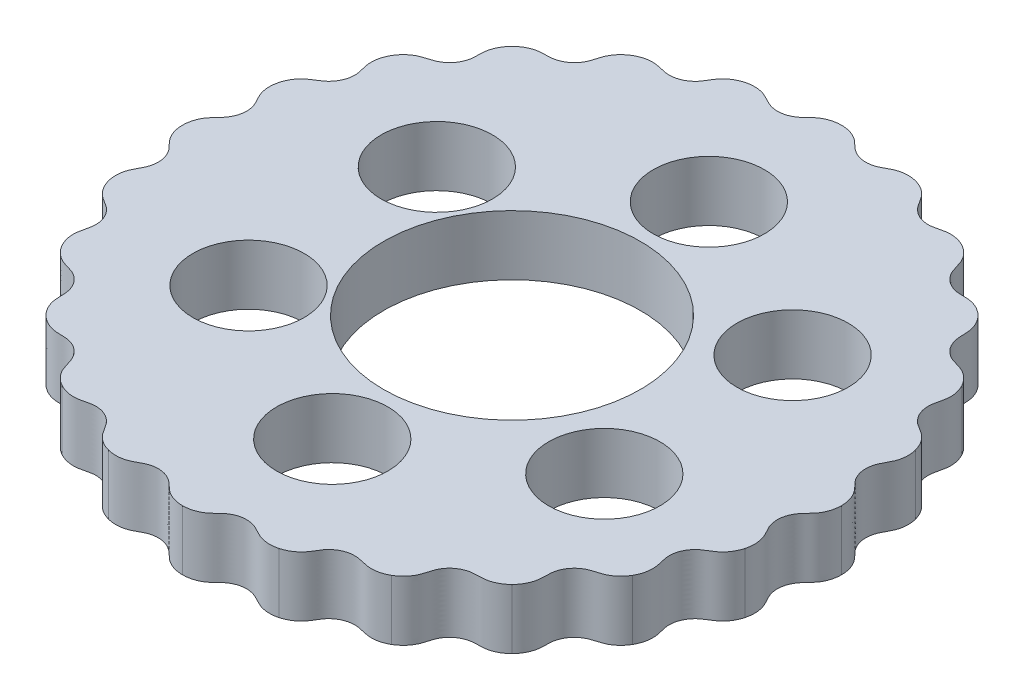
from build123d import *

# Parameters (mm, degrees)
SKETCH1_R           = 15
SKETCH1_R_2         = 6.5
BOSS_EXTRUDE1_DEPTH = 7


with BuildPart() as part:
    # Sketch1 → Boss-Extrude1 (new body)
    with BuildSketch(Plane(origin=(0, 0, 0), x_dir=(1, 0, 0), z_dir=(0, 1, 0))):
        with BuildLine():
            add(Edge.make_bspline(
                [(-38.188097082, 9.9647088), (-38.113372009, 10.244100974), (-37.951839108, 10.654037682), (-37.652977987, 11.14456219), (-37.390260931, 11.479949616), (-37.145465578, 11.725596787), (-36.927714992, 11.908277882), (-36.752948947, 12.0384598), (-36.590559186, 12.146195792), (-36.458882173, 12.226744009), (-36.305001509, 12.317396194), (-36.107721818, 12.43804004), (-35.856239089, 12.594685167), (-35.413957853, 12.936912027), (-35.008192839, 13.424260923), (-34.730315468, 13.922699482), (-34.557012484, 14.436902449), (-34.457602125, 15.223415448), (-34.576890778, 15.867285655), (-34.632823051, 16.071325063), (-34.673334751, 16.238891625), (-34.711262719, 16.392459936), (-34.752702236, 16.572074341), (-34.794830164, 16.780749484), (-34.825838307, 16.988053197), (-34.8500137, 17.262666694), (-34.849186563, 17.61539272), (-34.797869935, 18.037592245), (-34.662664385, 18.594763053), (-34.486664191, 18.999578144), (-34.341886986, 19.250157358)],
                knots=[-8.4146e-05, -8.4146e-05, -8.4146e-05, -8.4146e-05, 0.124936892, 0.187447412, 0.249957931, 0.31246845, 0.34372371, 0.37497897, 0.406234229, 0.421861859, 0.437489489, 0.453117119, 0.468744749, 0.484372378, 0.492186193, 0.500000008, 0.507813823, 0.515627638, 0.531255268, 0.546882898, 0.562510528, 0.578138157, 0.593765787, 0.625021047, 0.656276307, 0.687531566, 0.750042086, 0.812552605, 0.875063124, 1.000084163, 1.000084163, 1.000084163, 1.000084163], degree=3))
            add(Edge.make_bspline(
                [(-34.341886986, 19.250157358), (-34.197396092, 19.500689201), (-33.935267864, 19.854849864), (-33.519633104, 20.251309204), (-33.179063261, 20.507272404), (-32.879030942, 20.681191651), (-32.62141868, 20.801290039), (-32.418914084, 20.881803336), (-32.234173493, 20.943838749), (-32.086135853, 20.987561834), (-31.914036033, 21.035297874), (-31.69225356, 21.100771139), (-31.408797155, 21.186990194), (-30.893011458, 21.403085149), (-30.374937375, 21.768808321), (-29.977523054, 22.178343042), (-29.677039705, 22.630170855), (-29.377452129, 23.364154779), (-29.326030247, 24.016959816), (-29.32724739, 24.228523087), (-29.323009269, 24.400865157), (-29.31989847, 24.559017234), (-29.31343834, 24.743236764), (-29.300121693, 24.955704984), (-29.27641911, 25.163970492), (-29.228695543, 25.435483813), (-29.136604377, 25.775976912), (-28.977763043, 26.170508616), (-28.702958094, 26.673700518), (-28.428181106, 27.019169667), (-28.223482392, 27.223739503)],
                knots=[-8.4146e-05, -8.4146e-05, -8.4146e-05, -8.4146e-05, 0.124936892, 0.187447412, 0.249957931, 0.31246845, 0.34372371, 0.37497897, 0.406234229, 0.421861859, 0.437489489, 0.453117119, 0.468744749, 0.484372378, 0.492186193, 0.500000008, 0.507813823, 0.515627638, 0.531255268, 0.546882898, 0.562510528, 0.578138157, 0.593765787, 0.625021047, 0.656276307, 0.687531566, 0.750042086, 0.812552605, 0.875063124, 1.000084163, 1.000084163, 1.000084163, 1.000084163], degree=3))
            add(Edge.make_bspline(
                [(-28.223482392, 27.223739503), (-28.019072493, 27.428337686), (-27.674212543, 27.702586839), (-27.170128967, 27.977962964), (-26.774915608, 28.137058467), (-26.440093029, 28.227397481), (-26.160174942, 28.276728657), (-25.943732148, 28.302086483), (-25.749230494, 28.314193708), (-25.594920747, 28.318112004), (-25.41633009, 28.319678767), (-25.185158943, 28.325519557), (-24.889045948, 28.335436852), (-24.334905732, 28.410673388), (-23.739828474, 28.629847406), (-23.249960332, 28.922569175), (-22.842774062, 29.281230515), (-22.363425666, 29.912665573), (-22.144797566, 30.529917856), (-22.091216632, 30.734587303), (-22.042517512, 30.899960052), (-21.998579941, 31.051918094), (-21.944660412, 31.228188491), (-21.876806697, 31.42997043), (-21.800008679, 31.625004783), (-21.683638435, 31.874914744), (-21.506559101, 32.179970874), (-21.251017835, 32.519948074), (-20.85534099, 32.934869374), (-20.500512806, 33.197449429), (-20.249842461, 33.342068792)],
                knots=[-8.4146e-05, -8.4146e-05, -8.4146e-05, -8.4146e-05, 0.124936892, 0.187447412, 0.249957931, 0.31246845, 0.34372371, 0.37497897, 0.406234229, 0.421861859, 0.437489489, 0.453117119, 0.468744749, 0.484372378, 0.492186193, 0.500000008, 0.507813823, 0.515627638, 0.531255268, 0.546882898, 0.562510528, 0.578138157, 0.593765787, 0.625021047, 0.656276307, 0.687531566, 0.750042086, 0.812552605, 0.875063124, 1.000084163, 1.000084163, 1.000084163, 1.000084163], degree=3))
            add(Edge.make_bspline(
                [(-20.249842461, 33.342068792), (-19.999443754, 33.486790286), (-19.595353719, 33.662438303), (-19.037173788, 33.797964783), (-18.614250052, 33.849350495), (-18.267454818, 33.849952821), (-17.984306861, 33.825154945), (-17.768676088, 33.793629208), (-17.577668336, 33.754983156), (-17.427602437, 33.718829639), (-17.254691601, 33.674120352), (-17.029885713, 33.619930626), (-16.741295738, 33.552870315), (-16.186564743, 33.482121187), (-15.555037841, 33.539809704), (-15.006099582, 33.695770015), (-14.519959463, 33.936822705), (-13.893517049, 34.422677641), (-13.522581874, 34.962312446), (-13.417854315, 35.146140185), (-13.328012961, 35.293273735), (-13.24624289, 35.428682052), (-13.148538489, 35.584990779), (-13.030771824, 35.762335332), (-12.906112031, 35.930847261), (-12.729025549, 36.142122911), (-12.479025711, 36.390953001), (-12.144199228, 36.653206813), (-11.65461521, 36.951581309), (-11.243916784, 37.113377874), (-10.964357579, 37.188191192)],
                knots=[-8.4146e-05, -8.4146e-05, -8.4146e-05, -8.4146e-05, 0.124936892, 0.187447412, 0.249957931, 0.31246845, 0.34372371, 0.37497897, 0.406234229, 0.421861859, 0.437489489, 0.453117119, 0.468744749, 0.484372378, 0.492186193, 0.500000008, 0.507813823, 0.515627638, 0.531255268, 0.546882898, 0.562510528, 0.578138157, 0.593765787, 0.625021047, 0.656276307, 0.687531566, 0.750042086, 0.812552605, 0.875063124, 1.000084163, 1.000084163, 1.000084163, 1.000084163], degree=3))
            add(Edge.make_bspline(
                [(-10.964357579, 37.188191192), (-10.685034322, 37.263173466), (-10.249252269, 37.328250225), (-9.675015023, 37.314691156), (-9.253202464, 37.254865224), (-8.918068097, 37.165689816), (-8.650986335, 37.068452823), (-8.450862464, 36.982191949), (-8.276365478, 36.895426285), (-8.140770169, 36.821664756), (-7.985322742, 36.733726284), (-7.782202261, 36.623198983), (-7.520802237, 36.483731115), (-7.003284465, 36.271817759), (-6.378345433, 36.164089397), (-5.807746293, 36.172659814), (-5.275781969, 36.279676511), (-4.544936552, 36.586841114), (-4.046972922, 37.012083221), (-3.898235749, 37.162541695), (-3.773374699, 37.281409137), (-3.659344625, 37.391039876), (-3.524513745, 37.516734753), (-3.364859734, 37.657556181), (-3.200833523, 37.788061877), (-2.975098956, 37.946305129), (-2.669215688, 38.121951821), (-2.27792186, 38.28861008), (-1.727795011, 38.450104043), (-1.289214762, 38.500090949), (-0.999818195, 38.499999819)],
                knots=[-8.4146e-05, -8.4146e-05, -8.4146e-05, -8.4146e-05, 0.124936892, 0.187447412, 0.249957931, 0.31246845, 0.34372371, 0.37497897, 0.406234229, 0.421861859, 0.437489489, 0.453117119, 0.468744749, 0.484372378, 0.492186193, 0.500000008, 0.507813823, 0.515627638, 0.531255268, 0.546882898, 0.562510528, 0.578138157, 0.593765787, 0.625021047, 0.656276307, 0.687531566, 0.750042086, 0.812552605, 0.875063124, 1.000084163, 1.000084163, 1.000084163, 1.000084163], degree=3))
            add(Edge.make_bspline(
                [(-0.999818195, 38.499999819), (-0.710605806, 38.500132956), (-0.272829562, 38.450203583), (0.278331679, 38.288482992), (0.670287233, 38.121522456), (0.970921879, 37.948646469), (1.203736266, 37.7855969), (1.374715124, 37.650479424), (1.520809663, 37.521507086), (1.632693786, 37.415164271), (1.760084318, 37.289989475), (1.927677066, 37.130656852), (2.14407316, 36.928285931), (2.58910973, 36.589649892), (3.164872328, 36.323846162), (3.718246961, 36.184442624), (4.259782999, 36.150130318), (5.045225512, 36.257671828), (5.636282199, 36.53954169), (5.818892795, 36.646377402), (5.970264465, 36.728878117), (6.108783582, 36.805260125), (6.271552439, 36.891775253), (6.462213639, 36.986476808), (6.654428151, 37.070082523), (6.913427368, 37.164509362), (7.254348625, 37.255002623), (7.67544377, 37.314707844), (8.248623215, 37.328315728), (8.685196768, 37.263086451), (8.9647088, 37.188097082)],
                knots=[-8.4146e-05, -8.4146e-05, -8.4146e-05, -8.4146e-05, 0.124936892, 0.187447412, 0.249957931, 0.31246845, 0.34372371, 0.37497897, 0.406234229, 0.421861859, 0.437489489, 0.453117119, 0.468744749, 0.484372378, 0.492186193, 0.500000008, 0.507813823, 0.515627638, 0.531255268, 0.546882898, 0.562510528, 0.578138157, 0.593765787, 0.625021047, 0.656276307, 0.687531566, 0.750042086, 0.812552605, 0.875063124, 1.000084163, 1.000084163, 1.000084163, 1.000084163], degree=3))
            add(Edge.make_bspline(
                [(8.9647088, 37.188097082), (9.244100974, 37.113372009), (9.654037682, 36.951839108), (10.14456219, 36.652977987), (10.479949616, 36.390260931), (10.725596787, 36.145465578), (10.908277882, 35.927714992), (11.0384598, 35.752948947), (11.146195792, 35.590559186), (11.226744009, 35.458882173), (11.317396194, 35.305001509), (11.43804004, 35.107721818), (11.594685167, 34.856239089), (11.936912027, 34.413957853), (12.424260923, 34.008192839), (12.922699482, 33.730315468), (13.436902449, 33.557012484), (14.223415448, 33.457602125), (14.867285655, 33.576890778), (15.071325063, 33.632823051), (15.238891625, 33.673334751), (15.392459936, 33.711262719), (15.572074341, 33.752702236), (15.780749484, 33.794830164), (15.988053197, 33.825838307), (16.262666694, 33.8500137), (16.61539272, 33.849186563), (17.037592245, 33.797869935), (17.594763053, 33.662664385), (17.999578144, 33.486664191), (18.250157358, 33.341886986)],
                knots=[-8.4146e-05, -8.4146e-05, -8.4146e-05, -8.4146e-05, 0.124936892, 0.187447412, 0.249957931, 0.31246845, 0.34372371, 0.37497897, 0.406234229, 0.421861859, 0.437489489, 0.453117119, 0.468744749, 0.484372378, 0.492186193, 0.500000008, 0.507813823, 0.515627638, 0.531255268, 0.546882898, 0.562510528, 0.578138157, 0.593765787, 0.625021047, 0.656276307, 0.687531566, 0.750042086, 0.812552605, 0.875063124, 1.000084163, 1.000084163, 1.000084163, 1.000084163], degree=3))
            add(Edge.make_bspline(
                [(18.250157358, 33.341886986), (18.500689201, 33.197396092), (18.854849864, 32.935267864), (19.251309204, 32.519633104), (19.507272404, 32.179063261), (19.681191651, 31.879030942), (19.801290039, 31.62141868), (19.881803336, 31.418914084), (19.943838749, 31.234173493), (19.987561834, 31.086135853), (20.035297874, 30.914036033), (20.100771139, 30.69225356), (20.186990194, 30.408797155), (20.403085149, 29.893011458), (20.768808321, 29.374937375), (21.178343042, 28.977523054), (21.630170855, 28.677039705), (22.364154779, 28.377452129), (23.016959816, 28.326030247), (23.228523087, 28.32724739), (23.400865157, 28.323009269), (23.559017234, 28.31989847), (23.743236764, 28.31343834), (23.955704984, 28.300121693), (24.163970492, 28.27641911), (24.435483813, 28.228695543), (24.775976912, 28.136604377), (25.170508616, 27.977763043), (25.673700518, 27.702958094), (26.019169667, 27.428181106), (26.223739503, 27.223482392)],
                knots=[-8.4146e-05, -8.4146e-05, -8.4146e-05, -8.4146e-05, 0.124936892, 0.187447412, 0.249957931, 0.31246845, 0.34372371, 0.37497897, 0.406234229, 0.421861859, 0.437489489, 0.453117119, 0.468744749, 0.484372378, 0.492186193, 0.500000008, 0.507813823, 0.515627638, 0.531255268, 0.546882898, 0.562510528, 0.578138157, 0.593765787, 0.625021047, 0.656276307, 0.687531566, 0.750042086, 0.812552605, 0.875063124, 1.000084163, 1.000084163, 1.000084163, 1.000084163], degree=3))
            add(Edge.make_bspline(
                [(26.223739503, 27.223482392), (26.428337686, 27.019072493), (26.702586839, 26.674212543), (26.977962964, 26.170128967), (27.137058467, 25.774915608), (27.227397481, 25.440093029), (27.276728657, 25.160174942), (27.302086483, 24.943732148), (27.314193708, 24.749230494), (27.318112004, 24.594920747), (27.319678767, 24.41633009), (27.325519557, 24.185158943), (27.335436852, 23.889045948), (27.410673388, 23.334905732), (27.629847406, 22.739828474), (27.922569175, 22.249960332), (28.281230515, 21.842774062), (28.912665573, 21.363425666), (29.529917856, 21.144797566), (29.734587303, 21.091216632), (29.899960052, 21.042517512), (30.051918094, 20.998579941), (30.228188491, 20.944660412), (30.42997043, 20.876806697), (30.625004783, 20.800008679), (30.874914744, 20.683638435), (31.179970874, 20.506559101), (31.519948074, 20.251017835), (31.934869374, 19.85534099), (32.197449429, 19.500512806), (32.342068792, 19.249842461)],
                knots=[-8.4146e-05, -8.4146e-05, -8.4146e-05, -8.4146e-05, 0.124936892, 0.187447412, 0.249957931, 0.31246845, 0.34372371, 0.37497897, 0.406234229, 0.421861859, 0.437489489, 0.453117119, 0.468744749, 0.484372378, 0.492186193, 0.500000008, 0.507813823, 0.515627638, 0.531255268, 0.546882898, 0.562510528, 0.578138157, 0.593765787, 0.625021047, 0.656276307, 0.687531566, 0.750042086, 0.812552605, 0.875063124, 1.000084163, 1.000084163, 1.000084163, 1.000084163], degree=3))
            add(Edge.make_bspline(
                [(32.342068792, 19.249842461), (32.486790286, 18.999443754), (32.662438303, 18.595353719), (32.797964783, 18.037173788), (32.849350495, 17.614250052), (32.849952821, 17.267454818), (32.825154945, 16.984306861), (32.793629208, 16.768676088), (32.754983156, 16.577668336), (32.718829639, 16.427602437), (32.674120352, 16.254691601), (32.619930626, 16.029885713), (32.552870315, 15.741295738), (32.482121187, 15.186564743), (32.539809704, 14.555037841), (32.695770015, 14.006099582), (32.936822705, 13.519959463), (33.422677641, 12.893517049), (33.962312446, 12.522581874), (34.146140185, 12.417854315), (34.293273735, 12.328012961), (34.428682052, 12.24624289), (34.584990779, 12.148538489), (34.762335332, 12.030771824), (34.930847261, 11.906112031), (35.142122911, 11.729025549), (35.390953001, 11.479025711), (35.653206813, 11.144199228), (35.951581309, 10.65461521), (36.113377874, 10.243916784), (36.188191192, 9.964357579)],
                knots=[-8.4146e-05, -8.4146e-05, -8.4146e-05, -8.4146e-05, 0.124936892, 0.187447412, 0.249957931, 0.31246845, 0.34372371, 0.37497897, 0.406234229, 0.421861859, 0.437489489, 0.453117119, 0.468744749, 0.484372378, 0.492186193, 0.500000008, 0.507813823, 0.515627638, 0.531255268, 0.546882898, 0.562510528, 0.578138157, 0.593765787, 0.625021047, 0.656276307, 0.687531566, 0.750042086, 0.812552605, 0.875063124, 1.000084163, 1.000084163, 1.000084163, 1.000084163], degree=3))
            add(Edge.make_bspline(
                [(36.188191192, 9.964357579), (36.263173466, 9.685034322), (36.328250225, 9.249252269), (36.314691156, 8.675015023), (36.254865224, 8.253202464), (36.165689816, 7.918068097), (36.068452823, 7.650986335), (35.982191949, 7.450862464), (35.895426285, 7.276365478), (35.821664756, 7.140770169), (35.733726284, 6.985322742), (35.623198983, 6.782202261), (35.483731115, 6.520802237), (35.271817759, 6.003284465), (35.164089397, 5.378345433), (35.172659814, 4.807746293), (35.279676511, 4.275781969), (35.586841114, 3.544936552), (36.012083221, 3.046972922), (36.162541695, 2.898235749), (36.281409137, 2.773374699), (36.391039876, 2.659344625), (36.516734753, 2.524513745), (36.657556181, 2.364859734), (36.788061877, 2.200833523), (36.946305129, 1.975098956), (37.121951821, 1.669215688), (37.28861008, 1.27792186), (37.450104043, 0.727795011), (37.500090949, 0.289214762), (37.499999819, -0.000181805)],
                knots=[-8.4146e-05, -8.4146e-05, -8.4146e-05, -8.4146e-05, 0.124936892, 0.187447412, 0.249957931, 0.31246845, 0.34372371, 0.37497897, 0.406234229, 0.421861859, 0.437489489, 0.453117119, 0.468744749, 0.484372378, 0.492186193, 0.500000008, 0.507813823, 0.515627638, 0.531255268, 0.546882898, 0.562510528, 0.578138157, 0.593765787, 0.625021047, 0.656276307, 0.687531566, 0.750042086, 0.812552605, 0.875063124, 1.000084163, 1.000084163, 1.000084163, 1.000084163], degree=3))
            add(Edge.make_bspline(
                [(37.499999819, -0.000181805), (37.500132956, -0.289394194), (37.450203583, -0.727170438), (37.288482992, -1.278331679), (37.121522456, -1.670287233), (36.948646469, -1.970921879), (36.7855969, -2.203736266), (36.650479424, -2.374715124), (36.521507086, -2.520809663), (36.415164271, -2.632693786), (36.289989475, -2.760084318), (36.130656852, -2.927677066), (35.928285931, -3.14407316), (35.589649892, -3.58910973), (35.323846162, -4.164872328), (35.184442624, -4.718246961), (35.150130318, -5.259782999), (35.257671828, -6.045225512), (35.53954169, -6.636282199), (35.646377402, -6.818892795), (35.728878117, -6.970264465), (35.805260125, -7.108783582), (35.891775253, -7.271552439), (35.986476808, -7.462213639), (36.070082523, -7.654428151), (36.164509362, -7.913427368), (36.255002623, -8.254348625), (36.314707844, -8.67544377), (36.328315728, -9.248623215), (36.263086451, -9.685196768), (36.188097082, -9.9647088)],
                knots=[-8.4146e-05, -8.4146e-05, -8.4146e-05, -8.4146e-05, 0.124936892, 0.187447412, 0.249957931, 0.31246845, 0.34372371, 0.37497897, 0.406234229, 0.421861859, 0.437489489, 0.453117119, 0.468744749, 0.484372378, 0.492186193, 0.500000008, 0.507813823, 0.515627638, 0.531255268, 0.546882898, 0.562510528, 0.578138157, 0.593765787, 0.625021047, 0.656276307, 0.687531566, 0.750042086, 0.812552605, 0.875063124, 1.000084163, 1.000084163, 1.000084163, 1.000084163], degree=3))
            add(Edge.make_bspline(
                [(36.188097082, -9.9647088), (36.113372009, -10.244100974), (35.951839108, -10.654037682), (35.652977987, -11.14456219), (35.390260931, -11.479949616), (35.145465578, -11.725596787), (34.927714992, -11.908277882), (34.752948947, -12.0384598), (34.590559186, -12.146195792), (34.458882173, -12.226744009), (34.305001509, -12.317396194), (34.107721818, -12.43804004), (33.856239089, -12.594685167), (33.413957853, -12.936912027), (33.008192839, -13.424260923), (32.730315468, -13.922699482), (32.557012484, -14.436902449), (32.457602125, -15.223415448), (32.576890778, -15.867285655), (32.632823051, -16.071325063), (32.673334751, -16.238891625), (32.711262719, -16.392459936), (32.752702236, -16.572074341), (32.794830164, -16.780749484), (32.825838307, -16.988053197), (32.8500137, -17.262666694), (32.849186563, -17.61539272), (32.797869935, -18.037592245), (32.662664385, -18.594763053), (32.486664191, -18.999578144), (32.341886986, -19.250157358)],
                knots=[-8.4146e-05, -8.4146e-05, -8.4146e-05, -8.4146e-05, 0.124936892, 0.187447412, 0.249957931, 0.31246845, 0.34372371, 0.37497897, 0.406234229, 0.421861859, 0.437489489, 0.453117119, 0.468744749, 0.484372378, 0.492186193, 0.500000008, 0.507813823, 0.515627638, 0.531255268, 0.546882898, 0.562510528, 0.578138157, 0.593765787, 0.625021047, 0.656276307, 0.687531566, 0.750042086, 0.812552605, 0.875063124, 1.000084163, 1.000084163, 1.000084163, 1.000084163], degree=3))
            add(Edge.make_bspline(
                [(32.341886986, -19.250157358), (32.197396092, -19.500689201), (31.935267864, -19.854849864), (31.519633104, -20.251309204), (31.179063261, -20.507272404), (30.879030942, -20.681191651), (30.62141868, -20.801290039), (30.418914084, -20.881803336), (30.234173493, -20.943838749), (30.086135853, -20.987561834), (29.914036033, -21.035297874), (29.69225356, -21.100771139), (29.408797155, -21.186990194), (28.893011458, -21.403085149), (28.374937375, -21.768808321), (27.977523054, -22.178343042), (27.677039705, -22.630170855), (27.377452129, -23.364154779), (27.326030247, -24.016959816), (27.32724739, -24.228523087), (27.323009269, -24.400865157), (27.31989847, -24.559017234), (27.31343834, -24.743236764), (27.300121693, -24.955704984), (27.27641911, -25.163970492), (27.228695543, -25.435483813), (27.136604377, -25.775976912), (26.977763043, -26.170508616), (26.702958094, -26.673700518), (26.428181106, -27.019169667), (26.223482392, -27.223739503)],
                knots=[-8.4146e-05, -8.4146e-05, -8.4146e-05, -8.4146e-05, 0.124936892, 0.187447412, 0.249957931, 0.31246845, 0.34372371, 0.37497897, 0.406234229, 0.421861859, 0.437489489, 0.453117119, 0.468744749, 0.484372378, 0.492186193, 0.500000008, 0.507813823, 0.515627638, 0.531255268, 0.546882898, 0.562510528, 0.578138157, 0.593765787, 0.625021047, 0.656276307, 0.687531566, 0.750042086, 0.812552605, 0.875063124, 1.000084163, 1.000084163, 1.000084163, 1.000084163], degree=3))
            add(Edge.make_bspline(
                [(26.223482392, -27.223739503), (26.019072493, -27.428337686), (25.674212543, -27.702586839), (25.170128967, -27.977962964), (24.774915608, -28.137058467), (24.440093029, -28.227397481), (24.160174942, -28.276728657), (23.943732148, -28.302086483), (23.749230494, -28.314193708), (23.594920747, -28.318112004), (23.41633009, -28.319678767), (23.185158943, -28.325519557), (22.889045948, -28.335436852), (22.334905732, -28.410673388), (21.739828474, -28.629847406), (21.249960332, -28.922569175), (20.842774062, -29.281230515), (20.363425666, -29.912665573), (20.144797566, -30.529917856), (20.091216632, -30.734587303), (20.042517512, -30.899960052), (19.998579941, -31.051918094), (19.944660412, -31.228188491), (19.876806697, -31.42997043), (19.800008679, -31.625004783), (19.683638435, -31.874914744), (19.506559101, -32.179970874), (19.251017835, -32.519948074), (18.85534099, -32.934869374), (18.500512806, -33.197449429), (18.249842461, -33.342068792)],
                knots=[-8.4146e-05, -8.4146e-05, -8.4146e-05, -8.4146e-05, 0.124936892, 0.187447412, 0.249957931, 0.31246845, 0.34372371, 0.37497897, 0.406234229, 0.421861859, 0.437489489, 0.453117119, 0.468744749, 0.484372378, 0.492186193, 0.500000008, 0.507813823, 0.515627638, 0.531255268, 0.546882898, 0.562510528, 0.578138157, 0.593765787, 0.625021047, 0.656276307, 0.687531566, 0.750042086, 0.812552605, 0.875063124, 1.000084163, 1.000084163, 1.000084163, 1.000084163], degree=3))
            add(Edge.make_bspline(
                [(18.249842461, -33.342068792), (17.999443754, -33.486790286), (17.595353719, -33.662438303), (17.037173788, -33.797964783), (16.614250052, -33.849350495), (16.267454818, -33.849952821), (15.984306861, -33.825154945), (15.768676088, -33.793629208), (15.577668336, -33.754983156), (15.427602437, -33.718829639), (15.254691601, -33.674120352), (15.029885713, -33.619930626), (14.741295738, -33.552870315), (14.186564743, -33.482121187), (13.555037841, -33.539809704), (13.006099582, -33.695770015), (12.519959463, -33.936822705), (11.893517049, -34.422677641), (11.522581874, -34.962312446), (11.417854315, -35.146140185), (11.328012961, -35.293273735), (11.24624289, -35.428682052), (11.148538489, -35.584990779), (11.030771824, -35.762335332), (10.906112031, -35.930847261), (10.729025549, -36.142122911), (10.479025711, -36.390953001), (10.144199228, -36.653206813), (9.65461521, -36.951581309), (9.243916784, -37.113377874), (8.964357579, -37.188191192)],
                knots=[-8.4146e-05, -8.4146e-05, -8.4146e-05, -8.4146e-05, 0.124936892, 0.187447412, 0.249957931, 0.31246845, 0.34372371, 0.37497897, 0.406234229, 0.421861859, 0.437489489, 0.453117119, 0.468744749, 0.484372378, 0.492186193, 0.500000008, 0.507813823, 0.515627638, 0.531255268, 0.546882898, 0.562510528, 0.578138157, 0.593765787, 0.625021047, 0.656276307, 0.687531566, 0.750042086, 0.812552605, 0.875063124, 1.000084163, 1.000084163, 1.000084163, 1.000084163], degree=3))
            add(Edge.make_bspline(
                [(8.964357579, -37.188191192), (8.685034322, -37.263173466), (8.249252269, -37.328250225), (7.675015023, -37.314691156), (7.253202464, -37.254865224), (6.918068097, -37.165689816), (6.650986335, -37.068452823), (6.450862464, -36.982191949), (6.276365478, -36.895426285), (6.140770169, -36.821664756), (5.985322742, -36.733726284), (5.782202261, -36.623198983), (5.520802237, -36.483731115), (5.003284465, -36.271817759), (4.378345433, -36.164089397), (3.807746293, -36.172659814), (3.275781969, -36.279676511), (2.544936552, -36.586841114), (2.046972922, -37.012083221), (1.898235749, -37.162541695), (1.773374699, -37.281409137), (1.659344625, -37.391039876), (1.524513745, -37.516734753), (1.364859734, -37.657556181), (1.200833523, -37.788061877), (0.975098956, -37.946305129), (0.669215688, -38.121951821), (0.27792186, -38.28861008), (-0.272204989, -38.450104043), (-0.710785238, -38.500090949), (-1.000181805, -38.499999819)],
                knots=[-8.4146e-05, -8.4146e-05, -8.4146e-05, -8.4146e-05, 0.124936892, 0.187447412, 0.249957931, 0.31246845, 0.34372371, 0.37497897, 0.406234229, 0.421861859, 0.437489489, 0.453117119, 0.468744749, 0.484372378, 0.492186193, 0.500000008, 0.507813823, 0.515627638, 0.531255268, 0.546882898, 0.562510528, 0.578138157, 0.593765787, 0.625021047, 0.656276307, 0.687531566, 0.750042086, 0.812552605, 0.875063124, 1.000084163, 1.000084163, 1.000084163, 1.000084163], degree=3))
            add(Edge.make_bspline(
                [(-1.000181805, -38.499999819), (-1.289394194, -38.500132956), (-1.727170438, -38.450203583), (-2.278331679, -38.288482992), (-2.670287233, -38.121522456), (-2.970921879, -37.948646469), (-3.203736266, -37.7855969), (-3.374715124, -37.650479424), (-3.520809663, -37.521507086), (-3.632693786, -37.415164271), (-3.760084318, -37.289989475), (-3.927677066, -37.130656852), (-4.14407316, -36.928285931), (-4.58910973, -36.589649892), (-5.164872328, -36.323846162), (-5.718246961, -36.184442624), (-6.259782999, -36.150130318), (-7.045225512, -36.257671828), (-7.636282199, -36.53954169), (-7.818892795, -36.646377402), (-7.970264465, -36.728878117), (-8.108783582, -36.805260125), (-8.271552439, -36.891775253), (-8.462213639, -36.986476808), (-8.654428151, -37.070082523), (-8.913427368, -37.164509362), (-9.254348625, -37.255002623), (-9.67544377, -37.314707844), (-10.248623215, -37.328315728), (-10.685196768, -37.263086451), (-10.9647088, -37.188097082)],
                knots=[-8.4146e-05, -8.4146e-05, -8.4146e-05, -8.4146e-05, 0.124936892, 0.187447412, 0.249957931, 0.31246845, 0.34372371, 0.37497897, 0.406234229, 0.421861859, 0.437489489, 0.453117119, 0.468744749, 0.484372378, 0.492186193, 0.500000008, 0.507813823, 0.515627638, 0.531255268, 0.546882898, 0.562510528, 0.578138157, 0.593765787, 0.625021047, 0.656276307, 0.687531566, 0.750042086, 0.812552605, 0.875063124, 1.000084163, 1.000084163, 1.000084163, 1.000084163], degree=3))
            add(Edge.make_bspline(
                [(-10.9647088, -37.188097082), (-11.244100974, -37.113372009), (-11.654037682, -36.951839108), (-12.14456219, -36.652977987), (-12.479949616, -36.390260931), (-12.725596787, -36.145465578), (-12.908277882, -35.927714992), (-13.0384598, -35.752948947), (-13.146195792, -35.590559186), (-13.226744009, -35.458882173), (-13.317396194, -35.305001509), (-13.43804004, -35.107721818), (-13.594685167, -34.856239089), (-13.936912027, -34.413957853), (-14.424260923, -34.008192839), (-14.922699482, -33.730315468), (-15.436902449, -33.557012484), (-16.223415448, -33.457602125), (-16.867285655, -33.576890778), (-17.071325063, -33.632823051), (-17.238891625, -33.673334751), (-17.392459936, -33.711262719), (-17.572074341, -33.752702236), (-17.780749484, -33.794830164), (-17.988053197, -33.825838307), (-18.262666694, -33.8500137), (-18.61539272, -33.849186563), (-19.037592245, -33.797869935), (-19.594763053, -33.662664385), (-19.999578144, -33.486664191), (-20.250157358, -33.341886986)],
                knots=[-8.4146e-05, -8.4146e-05, -8.4146e-05, -8.4146e-05, 0.124936892, 0.187447412, 0.249957931, 0.31246845, 0.34372371, 0.37497897, 0.406234229, 0.421861859, 0.437489489, 0.453117119, 0.468744749, 0.484372378, 0.492186193, 0.500000008, 0.507813823, 0.515627638, 0.531255268, 0.546882898, 0.562510528, 0.578138157, 0.593765787, 0.625021047, 0.656276307, 0.687531566, 0.750042086, 0.812552605, 0.875063124, 1.000084163, 1.000084163, 1.000084163, 1.000084163], degree=3))
            add(Edge.make_bspline(
                [(-20.250157358, -33.341886986), (-20.500689201, -33.197396092), (-20.854849864, -32.935267864), (-21.251309205, -32.519633104), (-21.507272404, -32.179063261), (-21.681191651, -31.879030942), (-21.801290039, -31.62141868), (-21.881803336, -31.418914084), (-21.943838749, -31.234173493), (-21.987561834, -31.086135853), (-22.035297874, -30.914036033), (-22.100771139, -30.69225356), (-22.186990194, -30.408797155), (-22.403085149, -29.893011458), (-22.768808321, -29.374937375), (-23.178343042, -28.977523054), (-23.630170855, -28.677039705), (-24.364154779, -28.377452129), (-25.016959816, -28.326030247), (-25.228523087, -28.32724739), (-25.400865157, -28.323009269), (-25.559017234, -28.31989847), (-25.743236764, -28.31343834), (-25.955704984, -28.300121693), (-26.163970492, -28.27641911), (-26.435483813, -28.228695543), (-26.775976912, -28.136604377), (-27.170508616, -27.977763043), (-27.673700518, -27.702958094), (-28.019169667, -27.428181106), (-28.223739503, -27.223482392)],
                knots=[-8.4146e-05, -8.4146e-05, -8.4146e-05, -8.4146e-05, 0.124936892, 0.187447412, 0.249957931, 0.31246845, 0.34372371, 0.37497897, 0.406234229, 0.421861859, 0.437489489, 0.453117119, 0.468744749, 0.484372378, 0.492186193, 0.500000008, 0.507813823, 0.515627638, 0.531255268, 0.546882898, 0.562510528, 0.578138157, 0.593765787, 0.625021047, 0.656276307, 0.687531566, 0.750042086, 0.812552605, 0.875063124, 1.000084163, 1.000084163, 1.000084163, 1.000084163], degree=3))
            add(Edge.make_bspline(
                [(-28.223739503, -27.223482392), (-28.428337686, -27.019072493), (-28.702586839, -26.674212543), (-28.977962964, -26.170128967), (-29.137058467, -25.774915608), (-29.227397481, -25.440093029), (-29.276728657, -25.160174942), (-29.302086483, -24.943732148), (-29.314193708, -24.749230494), (-29.318112004, -24.594920747), (-29.319678767, -24.41633009), (-29.325519557, -24.185158943), (-29.335436852, -23.889045948), (-29.410673388, -23.334905732), (-29.629847406, -22.739828474), (-29.922569175, -22.249960332), (-30.281230515, -21.842774062), (-30.912665573, -21.363425666), (-31.529917856, -21.144797566), (-31.734587303, -21.091216632), (-31.899960052, -21.042517512), (-32.051918094, -20.998579941), (-32.228188491, -20.944660412), (-32.42997043, -20.876806697), (-32.625004783, -20.800008679), (-32.874914744, -20.683638435), (-33.179970874, -20.506559101), (-33.519948074, -20.251017835), (-33.934869374, -19.85534099), (-34.197449429, -19.500512806), (-34.342068792, -19.249842461)],
                knots=[-8.4146e-05, -8.4146e-05, -8.4146e-05, -8.4146e-05, 0.124936892, 0.187447412, 0.249957931, 0.31246845, 0.34372371, 0.37497897, 0.406234229, 0.421861859, 0.437489489, 0.453117119, 0.468744749, 0.484372378, 0.492186193, 0.500000008, 0.507813823, 0.515627638, 0.531255268, 0.546882898, 0.562510528, 0.578138157, 0.593765787, 0.625021047, 0.656276307, 0.687531566, 0.750042086, 0.812552605, 0.875063124, 1.000084163, 1.000084163, 1.000084163, 1.000084163], degree=3))
            add(Edge.make_bspline(
                [(-34.342068792, -19.249842461), (-34.486790286, -18.999443754), (-34.662438303, -18.595353719), (-34.797964783, -18.037173788), (-34.849350495, -17.614250052), (-34.849952821, -17.267454818), (-34.825154945, -16.984306861), (-34.793629208, -16.768676088), (-34.754983156, -16.577668336), (-34.718829639, -16.427602437), (-34.674120352, -16.254691601), (-34.619930626, -16.029885713), (-34.552870315, -15.741295738), (-34.482121187, -15.186564743), (-34.539809704, -14.555037841), (-34.695770015, -14.006099582), (-34.936822705, -13.519959463), (-35.422677641, -12.893517049), (-35.962312446, -12.522581874), (-36.146140185, -12.417854315), (-36.293273735, -12.328012961), (-36.428682052, -12.24624289), (-36.584990779, -12.148538489), (-36.762335332, -12.030771824), (-36.930847261, -11.906112031), (-37.142122911, -11.729025549), (-37.390953001, -11.479025711), (-37.653206813, -11.144199228), (-37.951581309, -10.65461521), (-38.113377874, -10.243916784), (-38.188191192, -9.964357579)],
                knots=[-8.4146e-05, -8.4146e-05, -8.4146e-05, -8.4146e-05, 0.124936892, 0.187447412, 0.249957931, 0.31246845, 0.34372371, 0.37497897, 0.406234229, 0.421861859, 0.437489489, 0.453117119, 0.468744749, 0.484372378, 0.492186193, 0.500000008, 0.507813823, 0.515627638, 0.531255268, 0.546882898, 0.562510528, 0.578138157, 0.593765787, 0.625021047, 0.656276307, 0.687531566, 0.750042086, 0.812552605, 0.875063124, 1.000084163, 1.000084163, 1.000084163, 1.000084163], degree=3))
            add(Edge.make_bspline(
                [(-38.188191192, -9.964357579), (-38.263173466, -9.685034322), (-38.328250225, -9.249252269), (-38.314691156, -8.675015023), (-38.254865224, -8.253202464), (-38.165689816, -7.918068097), (-38.068452823, -7.650986335), (-37.982191949, -7.450862464), (-37.895426285, -7.276365478), (-37.821664756, -7.140770169), (-37.733726284, -6.985322742), (-37.623198983, -6.782202261), (-37.483731115, -6.520802237), (-37.271817759, -6.003284465), (-37.164089397, -5.378345433), (-37.172659814, -4.807746293), (-37.279676511, -4.275781969), (-37.586841114, -3.544936552), (-38.012083221, -3.046972922), (-38.162541695, -2.898235749), (-38.281409137, -2.773374699), (-38.391039876, -2.659344625), (-38.516734753, -2.524513745), (-38.657556181, -2.364859734), (-38.788061877, -2.200833523), (-38.946305129, -1.975098956), (-39.121951821, -1.669215688), (-39.28861008, -1.27792186), (-39.450104043, -0.727795011), (-39.500090949, -0.289214762), (-39.499999819, 0.000181805)],
                knots=[-8.4146e-05, -8.4146e-05, -8.4146e-05, -8.4146e-05, 0.124936892, 0.187447412, 0.249957931, 0.31246845, 0.34372371, 0.37497897, 0.406234229, 0.421861859, 0.437489489, 0.453117119, 0.468744749, 0.484372378, 0.492186193, 0.500000008, 0.507813823, 0.515627638, 0.531255268, 0.546882898, 0.562510528, 0.578138157, 0.593765787, 0.625021047, 0.656276307, 0.687531566, 0.750042086, 0.812552605, 0.875063124, 1.000084163, 1.000084163, 1.000084163, 1.000084163], degree=3))
            add(Edge.make_bspline(
                [(-39.499999819, 0.000181805), (-39.500132956, 0.289394194), (-39.450203583, 0.727170438), (-39.288482992, 1.278331679), (-39.121522456, 1.670287233), (-38.948646469, 1.970921879), (-38.7855969, 2.203736266), (-38.650479424, 2.374715124), (-38.521507086, 2.520809663), (-38.415164271, 2.632693786), (-38.289989475, 2.760084318), (-38.130656852, 2.927677066), (-37.928285931, 3.14407316), (-37.589649892, 3.58910973), (-37.323846162, 4.164872328), (-37.184442624, 4.718246961), (-37.150130318, 5.259782999), (-37.257671828, 6.045225512), (-37.53954169, 6.636282199), (-37.646377402, 6.818892795), (-37.728878117, 6.970264465), (-37.805260125, 7.108783582), (-37.891775253, 7.271552439), (-37.986476808, 7.462213639), (-38.070082523, 7.654428151), (-38.164509362, 7.913427368), (-38.255002623, 8.254348625), (-38.314707844, 8.67544377), (-38.328315728, 9.248623215), (-38.263086451, 9.685196768), (-38.188097082, 9.9647088)],
                knots=[-8.4146e-05, -8.4146e-05, -8.4146e-05, -8.4146e-05, 0.124936892, 0.187447412, 0.249957931, 0.31246845, 0.34372371, 0.37497897, 0.406234229, 0.421861859, 0.437489489, 0.453117119, 0.468744749, 0.484372378, 0.492186193, 0.500000008, 0.507813823, 0.515627638, 0.531255268, 0.546882898, 0.562510528, 0.578138157, 0.593765787, 0.625021047, 0.656276307, 0.687531566, 0.750042086, 0.812552605, 0.875063124, 1.000084163, 1.000084163, 1.000084163, 1.000084163], degree=3))
        make_face()
        with Locations(Location((-1, 0, 0), (0, 0, 270))):
            Circle(SKETCH1_R, mode=Mode.SUBTRACT)
        with Locations(Location((-1, 23, 0), (0, 0, 270))):
            Circle(SKETCH1_R_2, mode=Mode.SUBTRACT)
        with Locations(Location((19.418584287, 12.366025404, 0), (0, 0, 270))):
            Circle(SKETCH1_R_2, mode=Mode.SUBTRACT)
        with Locations(Location((20.418584287, -10.633974596, 0), (0, 0, 270))):
            Circle(SKETCH1_R_2, mode=Mode.SUBTRACT)
        with Locations(Location((1, -23, 0), (0, 0, 270))):
            Circle(SKETCH1_R_2, mode=Mode.SUBTRACT)
        with Locations(Location((-19.418584287, -12.366025404, 0), (0, 0, 270))):
            Circle(SKETCH1_R_2, mode=Mode.SUBTRACT)
        with Locations(Location((-20.418584287, 10.633974596, 0), (0, 0, 270))):
            Circle(SKETCH1_R_2, mode=Mode.SUBTRACT)
    extrude(amount=BOSS_EXTRUDE1_DEPTH)


solid = part.part
